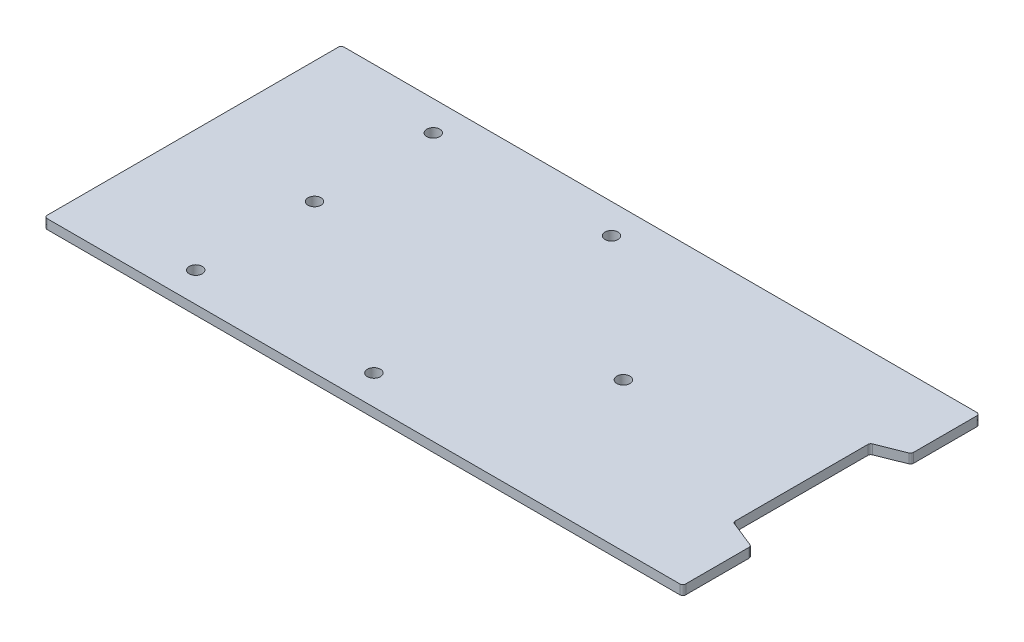
from build123d import *

# Parameters (mm, degrees)
BOSS_EXTRUDE1_DEPTH = 1.6
SKETCH2_R           = 1.1
CUT_EXTRUDE1_DEPTH  = 119.569852829


with BuildPart() as part:
    # Sketch1 → Boss-Extrude1 (new body)
    with BuildSketch(Plane(origin=(0, 0, 0), x_dir=(1, 0, 0), z_dir=(0, 1, 0))):
        with BuildLine():
            Line((102.5, 50), (106.992600234, 50))
            ThreePointArc((106.992600234, 50), (107.351386049, 49.851386049), (107.5, 49.492600234))
            Line((107.5, 49.492600234), (107.5, 38.843526366))
            ThreePointArc((107.5, 38.843526366), (107.412761353, 38.55906344), (107.181043776, 38.372417511))
            Line((107.181043776, 38.372417511), (102.818956224, 36.627582489))
            ThreePointArc((102.818956224, 36.627582489), (102.587238647, 36.44093656), (102.5, 36.156473634))
            Line((102.5, 36.156473634), (102.5, 13.843526366))
            ThreePointArc((102.5, 13.843526366), (102.587238647, 13.55906344), (102.818956224, 13.372417511))
            Line((102.818956224, 13.372417511), (107.181043776, 11.627582489))
            ThreePointArc((107.181043776, 11.627582489), (107.412761353, 11.44093656), (107.5, 11.156473634))
            Line((107.5, 11.156473634), (107.5, 0.507399766))
            ThreePointArc((107.5, 0.507399766), (107.351386049, 0.148613951), (106.992600234, 0))
            Line((106.992600234, 0), (102.5, 0))
            Line((102.5, 0), (0.507399766, 0))
            ThreePointArc((0.507399766, 0), (0.148613951, 0.148613951), (0, 0.507399766))
            Line((0, 0.507399766), (0, 49.492600234))
            ThreePointArc((0, 49.492600234), (0.148613951, 49.851386049), (0.507399766, 50))
            Line((0.507399766, 50), (102.5, 50))
        make_face()
    extrude(amount=BOSS_EXTRUDE1_DEPTH)

    # Sketch2 → Cut-Extrude1 (cut, through all)
    with BuildSketch(Plane(origin=(0, 1.6, 0), x_dir=(1, 0, 0), z_dir=(0, 1, 0))):
        with Locations(Location((20.5, 5, 0), (0, 0, 270))):
            Circle(SKETCH2_R)
        with Locations(Location((20.5, 25, 0), (0, 0, 270))):
            Circle(SKETCH2_R)
        with Locations(Location((20.5, 45, 0), (0, 0, 270))):
            Circle(SKETCH2_R)
        with Locations(Location((50.5, 45, 0), (0, 0, 270))):
            Circle(SKETCH2_R)
        with Locations(Location((50.5, 5, 0), (0, 0, 270))):
            Circle(SKETCH2_R)
        with Locations(Location((72.5, 25, 0), (0, 0, 270))):
            Circle(SKETCH2_R)
    extrude(amount=-CUT_EXTRUDE1_DEPTH, mode=Mode.SUBTRACT)


solid = part.part
